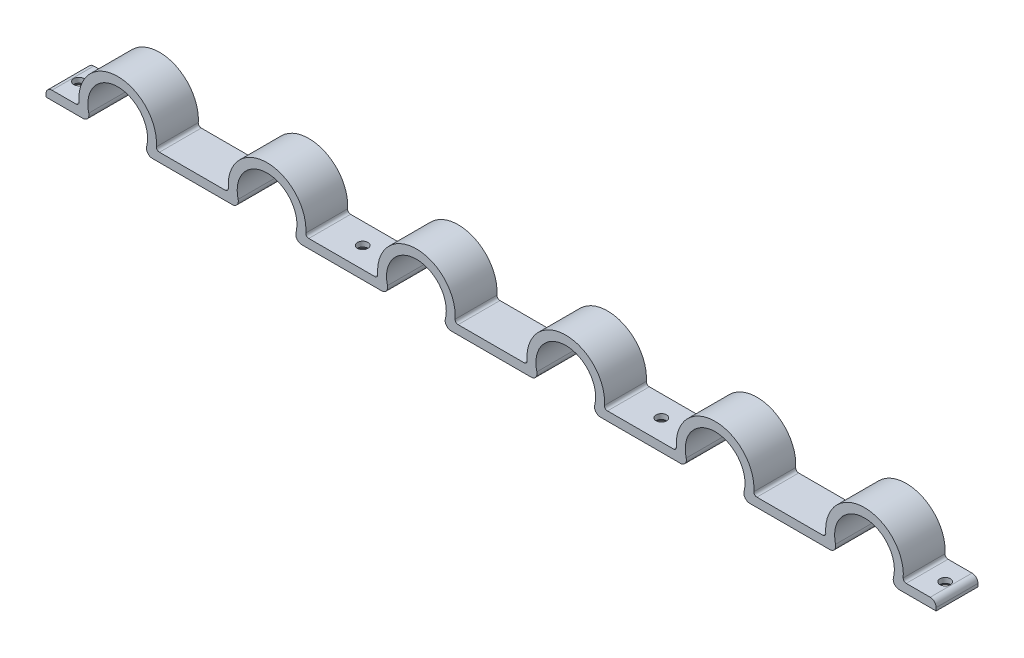
from build123d import *

# Parameters (mm, degrees)
EXTRU_MINCE1_DEPTH           = 14
CONG_1_R                     = 2
CONG_2_R                     = 1
CONG_3_R                     = 2
ENL_V_MAT_EXTRU_1_DEPTH      = 151.73486657
ENL_V_MAT_EXTRU_1_DEPTH_BACK = 151.73486657
ESQUISSE2_R                  = 1.75
CHANFREIN1_SIZE              = 1.3


with BuildPart() as part:
    # Esquisse1 → Extru.-Mince1 (new body)
    with BuildSketch(Plane.XY):
        with BuildLine():
            Line((-149, 0), (-133.660254038, 0))
            ThreePointArc((-133.660254038, 0), (-125, 15), (-116.339745962, 0))
            Line((-116.339745962, 0), (-83.660254038, 0))
            ThreePointArc((-83.660254038, 0), (-75, 15), (-66.339745962, 0))
            Line((-66.339745962, 0), (-33.660254038, 0))
            ThreePointArc((-33.660254038, 0), (-25, 15), (-16.339745962, 0))
            Line((-16.339745962, 0), (16.339745962, 0))
            ThreePointArc((16.339745962, 0), (25, 15), (33.660254038, 0))
            Line((33.660254038, 0), (66.339745962, 0))
            ThreePointArc((66.339745962, 0), (75, 15), (83.660254038, 0))
            Line((83.660254038, 0), (116.339745962, 0))
            ThreePointArc((116.339745962, 0), (125, 15), (133.660254038, 0))
            Line((133.660254038, 0), (149, 0))
            Line((149, 0), (149, 3))
            Line((149, 3), (137.845232579, 3))
            ThreePointArc((137.845232579, 3), (125, 18), (112.154767421, 3))
            Line((112.154767421, 3), (87.845232579, 3))
            ThreePointArc((87.845232579, 3), (75, 18), (62.154767421, 3))
            Line((62.154767421, 3), (37.845232579, 3))
            ThreePointArc((37.845232579, 3), (25, 18), (12.154767421, 3))
            Line((12.154767421, 3), (-12.154767421, 3))
            ThreePointArc((-12.154767421, 3), (-25, 18), (-37.845232579, 3))
            Line((-37.845232579, 3), (-62.154767421, 3))
            ThreePointArc((-62.154767421, 3), (-75, 18), (-87.845232579, 3))
            Line((-87.845232579, 3), (-112.154767421, 3))
            ThreePointArc((-112.154767421, 3), (-125, 18), (-137.845232579, 3))
            Line((-137.845232579, 3), (-149, 3))
            Line((-149, 3), (-149, 0))
        make_face()
    extrude(amount=EXTRU_MINCE1_DEPTH)

    # Congé1
    cong_1_edges = [part.edges().sort_by_distance(p)[0] for p in [
        (133.660254038, 0, 7),
        (116.339745962, 0, 7),
        (83.660254038, 0, 7),
        (66.339745962, 0, 7),
        (33.660254038, 0, 7),
        (16.339745962, 0, 7),
        (-16.339745962, 0, 7),
        (-33.660254038, 0, 7),
        (-66.339745962, 0, 7),
        (-83.660254038, 0, 7),
        (-116.339745962, 0, 7),
        (-133.660254038, 0, 7),
    ]]
    fillet(cong_1_edges, radius=CONG_1_R)

    # Congé2
    cong_2_edges = [part.edges().sort_by_distance(p)[0] for p in [
        (-137.845232579, 3, 7),
        (-112.154767421, 3, 7),
        (-87.845232579, 3, 7),
        (-62.154767421, 3, 7),
        (-37.845232579, 3, 7),
        (-12.154767421, 3, 7),
        (12.154767421, 3, 7),
        (37.845232579, 3, 7),
        (62.154767421, 3, 7),
        (87.845232579, 3, 7),
        (112.154767421, 3, 7),
        (137.845232579, 3, 7),
    ]]
    fillet(cong_2_edges, radius=CONG_2_R)

    # Congé3
    cong_3_edges = [part.edges().sort_by_distance(p)[0] for p in [
        (149, 3, 7),
        (-149, 3, 7),
    ]]
    fillet(cong_3_edges, radius=CONG_3_R)

    # Esquisse2 → Enlèv. mat.-Extru.1 (cut, two sides: drawn at the far end of the back side and taken through both)
    with BuildSketch(Plane.XZ.offset(-ENL_V_MAT_EXTRU_1_DEPTH_BACK)):
        with Locations((-145, 7)):
            Circle(ESQUISSE2_R)
        with Locations((145, 7)):
            Circle(ESQUISSE2_R)
        with Locations(Location((-50, 7, 0), (0, 0, 270))):
            Circle(ESQUISSE2_R)
        with Locations(Location((50, 7, 0), (0, 0, 270))):
            Circle(ESQUISSE2_R)
    extrude(amount=ENL_V_MAT_EXTRU_1_DEPTH + ENL_V_MAT_EXTRU_1_DEPTH_BACK, mode=Mode.SUBTRACT)

    # Chanfrein1
    chanfrein1_edges = [part.edges().sort_by_distance(p)[0] for p in [
        (-146.75, 0, 7),
        (50, 0, 8.75),
        (-50, 0, 8.75),
        (143.25, 0, 7),
    ]]
    chamfer(chanfrein1_edges, length=CHANFREIN1_SIZE)


solid = part.part
